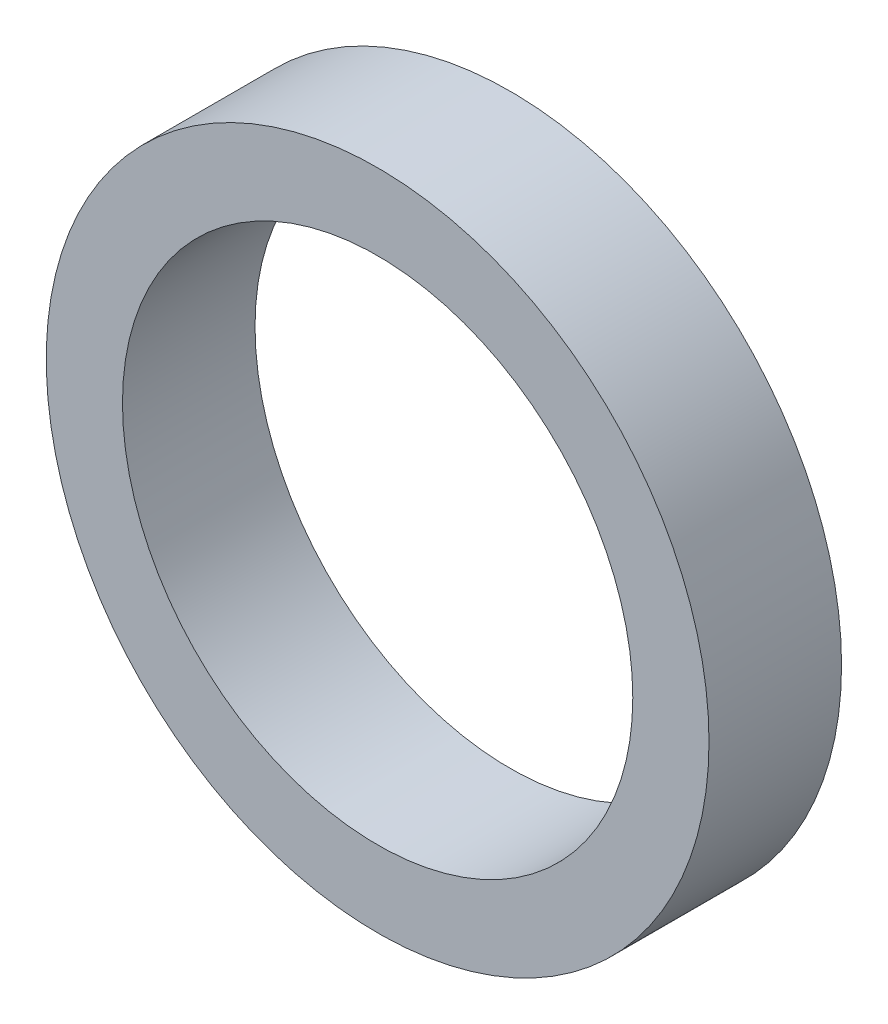
from build123d import *

# Parameters (mm, degrees)
SZKIC1_R                    = 5
SZKIC1_R_2                  = 3.85
DODANIE_WYCI_GNI_CIE1_DEPTH = 2


with BuildPart() as part:
    # Szkic1 → Dodanie-wyciągnięcie1 (new body)
    with BuildSketch(Plane.XY):
        Circle(SZKIC1_R)
        Circle(SZKIC1_R_2, mode=Mode.SUBTRACT)
    extrude(amount=DODANIE_WYCI_GNI_CIE1_DEPTH)


solid = part.part
